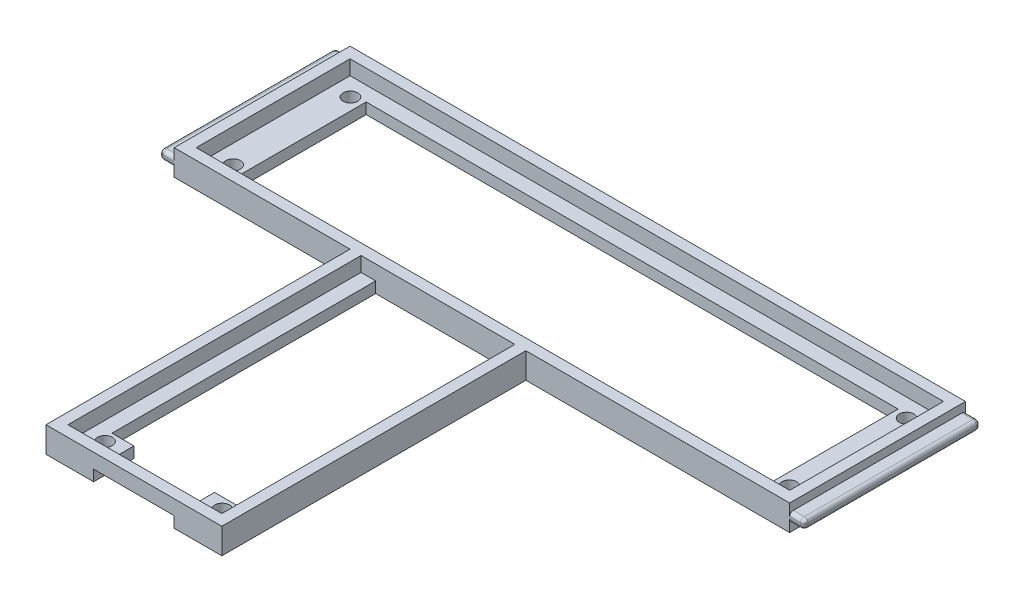
from build123d import *

# Parameters (mm, degrees)
SKETCH2_W            = 84
SKETCH2_H            = 24
BOSS_EXTRUDE1_DEPTH  = 1.5
SKETCH3_W            = 84
SKETCH3_H            = 24
SKETCH3_W_2          = 81
SKETCH3_H_2          = 21
BOSS_EXTRUDE2_DEPTH  = 2
CUT_EXTRUDE1_REACH   = 45.821
SKETCH4_R            = 1
SKETCH5_W            = 72.6
SKETCH5_H            = 17
CUT_EXTRUDE2_DEPTH   = 44.726422218
SKETCH8_W            = 24
SKETCH8_H            = 1.25
BOSS_EXTRUDE4_DEPTH  = 2
FILLET1_R            = 0.5
FILLET1_OF_MIRROR1_R = 0.5
SKETCH9_W            = 24
SKETCH9_H            = 41.5
BOSS_EXTRUDE5_DEPTH  = 1.5
BOSS_EXTRUDE6_DEPTH  = 2
SKETCH11_R           = 1
CUT_EXTRUDE4_DEPTH   = 70.298268377
SKETCH12_W           = 17
SKETCH12_H           = 36
CUT_EXTRUDE5_DEPTH   = 70.298268377
SKETCH13_W           = 11
SKETCH13_H           = 5.5
CUT_EXTRUDE6_DEPTH   = 1.5


with BuildPart() as part:
    # Sketch2 → Boss-Extrude1 (new body)
    with BuildSketch(Plane(origin=(0, 0, 0), x_dir=(1, 0, 0), z_dir=(0, 1, 0))):
        Rectangle(SKETCH2_W, SKETCH2_H)
    extrude(amount=BOSS_EXTRUDE1_DEPTH)

    # Sketch3 → Boss-Extrude2 (add)
    with BuildSketch(Plane(origin=(0, 1.5, 0), x_dir=(1, 0, 0), z_dir=(0, 1, 0))):
        Rectangle(SKETCH3_W, SKETCH3_H)
        Rectangle(SKETCH3_W_2, SKETCH3_H_2, mode=Mode.SUBTRACT)
    extrude(amount=BOSS_EXTRUDE2_DEPTH)

    # Sketch4 → Cut-Extrude1 (cut, up to next)
    with BuildSketch(Plane.XZ, mode=Mode.PRIVATE) as cut_extrude1_sk1:
        with Locations(Location((-37.955, 8.005, 0), (0, 0, 270))):
            Circle(SKETCH4_R)
    cut_extrude1_tool1 = extrude(cut_extrude1_sk1.sketch, amount=-CUT_EXTRUDE1_REACH, mode=Mode.PRIVATE) & part.part
    # Sketch4 → Cut-Extrude1 (cut, up to next)
    with BuildSketch(Plane.XZ, mode=Mode.PRIVATE) as cut_extrude1_sk2:
        with Locations(Location((37.955, 8.005, 0), (0, 0, 270))):
            Circle(SKETCH4_R)
    cut_extrude1_tool2 = extrude(cut_extrude1_sk2.sketch, amount=-CUT_EXTRUDE1_REACH, mode=Mode.PRIVATE) & part.part
    # Sketch4 → Cut-Extrude1 (cut, up to next)
    with BuildSketch(Plane.XZ, mode=Mode.PRIVATE) as cut_extrude1_sk3:
        with Locations(Location((37.955, -8.005, 0), (0, 0, 270))):
            Circle(SKETCH4_R)
    cut_extrude1_tool3 = extrude(cut_extrude1_sk3.sketch, amount=-CUT_EXTRUDE1_REACH, mode=Mode.PRIVATE) & part.part
    # Sketch4 → Cut-Extrude1 (cut, up to next)
    with BuildSketch(Plane.XZ, mode=Mode.PRIVATE) as cut_extrude1_sk4:
        with Locations(Location((-37.955, -8.005, 0), (0, 0, 270))):
            Circle(SKETCH4_R)
    cut_extrude1_tool4 = extrude(cut_extrude1_sk4.sketch, amount=-CUT_EXTRUDE1_REACH, mode=Mode.PRIVATE) & part.part
    add(cut_extrude1_tool1.solids().sort_by_distance((-37.955, 0, 8.005))[0], mode=Mode.SUBTRACT)
    add(cut_extrude1_tool2.solids().sort_by_distance((37.955, 0, 8.005))[0], mode=Mode.SUBTRACT)
    add(cut_extrude1_tool3.solids().sort_by_distance((37.955, 0, -8.005))[0], mode=Mode.SUBTRACT)
    add(cut_extrude1_tool4.solids().sort_by_distance((-37.955, 0, -8.005))[0], mode=Mode.SUBTRACT)

    # Sketch5 → Cut-Extrude2 (cut, through all)
    with BuildSketch(Plane(origin=(0, 1.5, 0), x_dir=(1, 0, 0), z_dir=(0, 1, 0))):
        Rectangle(SKETCH5_W, SKETCH5_H)
    extrude(amount=-CUT_EXTRUDE2_DEPTH, mode=Mode.SUBTRACT)

    # Sketch8 → Boss-Extrude4 (add)
    with BuildSketch(Plane(origin=(42, 0, 0), x_dir=(0, 0, -1), z_dir=(1, 0, 0))):
        with Locations((0, 1.75)):
            Rectangle(SKETCH8_W, SKETCH8_H)
    boss_extrude4 = extrude(amount=BOSS_EXTRUDE4_DEPTH)

    # Fillet1
    fillet1_edges = [part.edges().sort_by_distance(p)[0] for p in [
        (43, 1.125, -12),
        (43, 2.375, -12),
        (43, 2.375, 12),
        (43, 1.125, 12),
        (44, 1.75, -12),
        (44, 2.375, 0),
        (44, 1.75, 12),
        (44, 1.125, 0),
    ]]
    fillet(fillet1_edges, radius=FILLET1_R)

    # Mirror1: Boss-Extrude4 across plane
    add(boss_extrude4.mirror(Plane(origin=(0, 0, 0), x_dir=(0, 0, 1), z_dir=(1, 0, 0))))

    # Fillet1 of Mirror1
    fillet1_of_mirror1_edges = [part.edges().sort_by_distance(p)[0] for p in [
        (-43, 1.125, -12),
        (-43, 2.375, -12),
        (-43, 2.375, 12),
        (-43, 1.125, 12),
        (-44, 1.75, -12),
        (-44, 2.375, 0),
        (-44, 1.75, 12),
        (-44, 1.125, 0),
    ]]
    fillet(fillet1_of_mirror1_edges, radius=FILLET1_OF_MIRROR1_R)

    # Sketch9 → Boss-Extrude5 (add)
    with BuildSketch(Plane(origin=(0, 0, 0), x_dir=(1, 0, 0), z_dir=(0, 1, 0))):
        with Locations((-6, -32.75)):
            Rectangle(SKETCH9_W, SKETCH9_H)
    extrude(amount=BOSS_EXTRUDE5_DEPTH)

    # Sketch10 → Boss-Extrude6 (add)
    with BuildSketch(Plane(origin=(0, 1.5, 0), x_dir=(1, 0, 0), z_dir=(0, 1, 0))):
        Polygon((-16.5, -52), (-16.5, -13.5), (-16.5, -12), (-18, -12), (-18, -53.5), (6, -53.5), (6, -12), (4.5, -12), (4.5, -13.5), (4.5, -52), align=None)
    extrude(amount=BOSS_EXTRUDE6_DEPTH)

    # Sketch11 → Cut-Extrude4 (cut, through all)
    with BuildSketch(Plane(origin=(0, 1.5, 0), x_dir=(1, 0, 0), z_dir=(0, 1, 0))):
        with Locations(Location((-14, -49.45, 0), (0, 0, 270))):
            Circle(SKETCH11_R)
        with Locations(Location((2, -49.45, 0), (0, 0, 270))):
            Circle(SKETCH11_R)
    extrude(amount=-CUT_EXTRUDE4_DEPTH, mode=Mode.SUBTRACT)

    # Sketch12 → Cut-Extrude5 (cut, through all)
    with BuildSketch(Plane(origin=(0, 1.5, 0), x_dir=(1, 0, 0), z_dir=(0, 1, 0))):
        with Locations((-6, -30)):
            Rectangle(SKETCH12_W, SKETCH12_H)
    extrude(amount=-CUT_EXTRUDE5_DEPTH, mode=Mode.SUBTRACT)

    # Sketch13 → Cut-Extrude6 (cut)
    with BuildSketch(Plane.XZ):
        with Locations((-6, 50.75)):
            Rectangle(SKETCH13_W, SKETCH13_H)
    extrude(amount=-CUT_EXTRUDE6_DEPTH, mode=Mode.SUBTRACT)


solid = part.part
